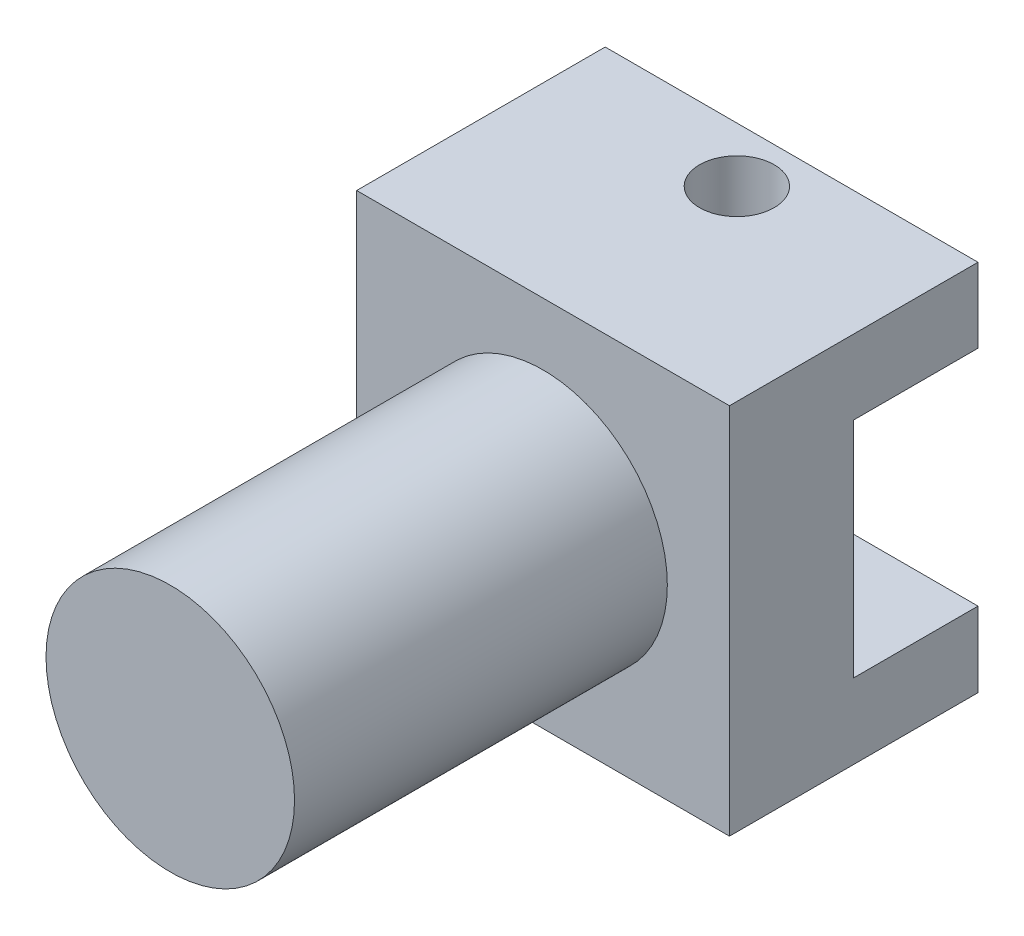
from build123d import *

# Parameters (mm, degrees)
SKETCH5_W           = 76.2
SKETCH5_H           = 76.2
BOSS_EXTRUDE3_DEPTH = 25.4
BOSS_EXTRUDE4_DEPTH = 76.2
SKETCH7_W           = 38.1
SKETCH7_H           = 15.221971119
SKETCH7_H_2         = 15.332492997
BOSS_EXTRUDE5_DEPTH = 25.4
SKETCH8_R           = 7.62
CUT_EXTRUDE1_DEPTH  = 149.106178129


with BuildPart() as part:
    # Sketch5 → Boss-Extrude3 (new body)
    with BuildSketch(Plane.XY):
        with Locations((38.1, 38.1)):
            Rectangle(SKETCH5_W, SKETCH5_H)
    extrude(amount=BOSS_EXTRUDE3_DEPTH)

    # Sketch6 → Boss-Extrude4 (add)
    with BuildSketch(Plane.XY.offset(25.4)):
        with BuildLine():
            ThreePointArc((63.5, 38.1), (56.060512242, 56.060512242), (38.1, 63.5))
            Line((38.1, 63.5), (38.1, 38.1))
            Line((38.1, 38.1), (63.5, 38.1))
        make_face()
        with BuildLine():
            Line((38.1, 38.1), (38.1, 63.5))
            ThreePointArc((38.1, 63.5), (20.139487758, 56.060512242), (12.7, 38.1))
            Line((12.7, 38.1), (38.1, 38.1))
        make_face()
        with BuildLine():
            Line((63.5, 38.1), (38.1, 38.1))
            Line((38.1, 38.1), (38.1, 12.7))
            ThreePointArc((38.1, 12.7), (56.060512242, 20.139487758), (63.5, 38.1))
        make_face()
        with BuildLine():
            Line((38.1, 12.7), (38.1, 38.1))
            Line((38.1, 38.1), (12.7, 38.1))
            ThreePointArc((12.7, 38.1), (20.139487758, 20.139487758), (38.1, 12.7))
        make_face()
    extrude(amount=BOSS_EXTRUDE4_DEPTH)

    # Sketch7 → Boss-Extrude5 (add)
    with BuildSketch(Plane(origin=(0, 0, 0), x_dir=(-1, 0, 0), z_dir=(0, 0, -1))):
        with Locations((-57.15, 68.589014441)):
            Rectangle(SKETCH7_W, SKETCH7_H)
        with Locations((-19.05, 68.589014441)):
            Rectangle(SKETCH7_W, SKETCH7_H)
        with Locations((-57.15, 7.666246499)):
            Rectangle(SKETCH7_W, SKETCH7_H_2)
        with Locations((-19.05, 7.666246499)):
            Rectangle(SKETCH7_W, SKETCH7_H_2)
    extrude(amount=BOSS_EXTRUDE5_DEPTH)

    # Sketch8 → Cut-Extrude1 (cut, through all)
    with BuildSketch(Plane.XZ):
        with Locations(Location((38.1, -14.21368923, 0), (0, 0, 270))):
            Circle(SKETCH8_R)
    extrude(amount=-CUT_EXTRUDE1_DEPTH, mode=Mode.SUBTRACT)


solid = part.part
